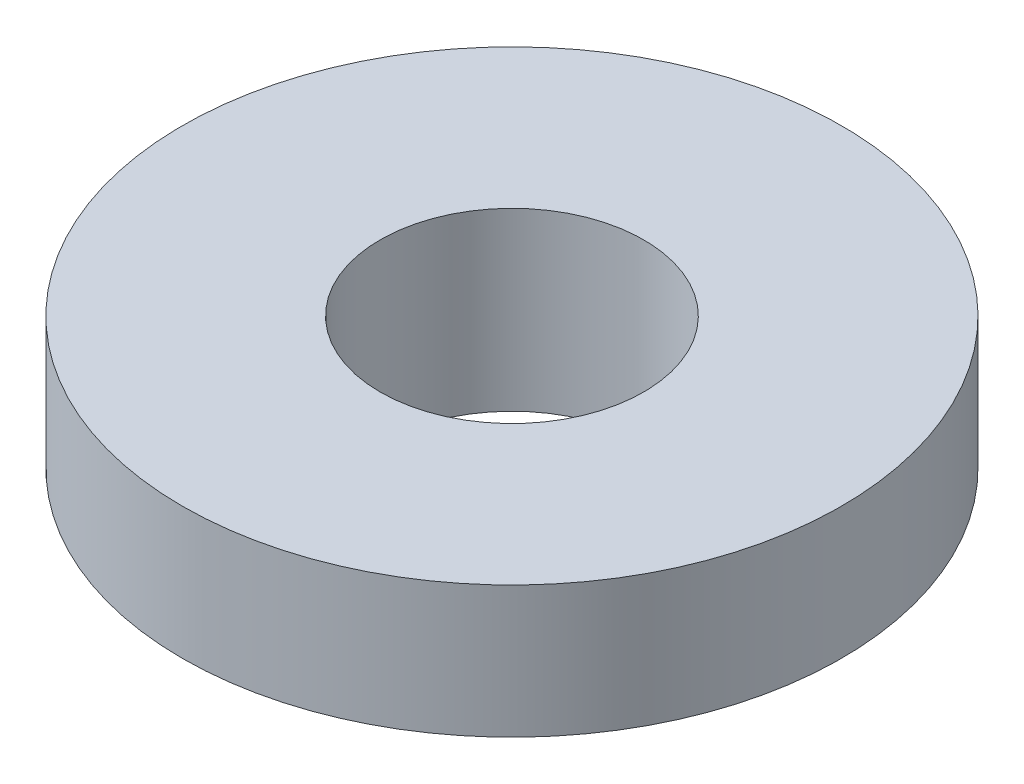
from build123d import *

# Parameters (mm, degrees)
ESQUISSE1_R        = 3.75
ESQUISSE1_R_2      = 2.5
ESQUISSE1_R_3      = 1.5
BOSS_EXTRU_1_DEPTH = 1.5
BOSS_EXTRU_2_START = -0.5
ESQUISSE1_3_R      = 2.5
ESQUISSE1_3_R_2    = 1.5
BOSS_EXTRU_2_DEPTH = 0.5


with BuildPart() as part:
    # Esquisse1 → Boss.-Extru.1 (new body)
    # profile 1 of 2: a face of its own
    with BuildSketch(Plane(origin=(0, 0, 0), x_dir=(1, 0, 0), z_dir=(0, 1, 0))):
        with Locations(Location((0, 0, 0), (0, 0, 270))):
            Circle(ESQUISSE1_R)
        Circle(ESQUISSE1_R_2, mode=Mode.SUBTRACT)
    # profile 2 of 2: a face of its own
    with BuildSketch(Plane(origin=(0, 0, 0), x_dir=(1, 0, 0), z_dir=(0, 1, 0))):
        Circle(ESQUISSE1_R_2)
        with Locations(Location((0, 0, 0), (0, 0, 270))):
            Circle(ESQUISSE1_R_3, mode=Mode.SUBTRACT)
    extrude(amount=BOSS_EXTRU_1_DEPTH)

    # Esquisse1<3> → Boss.-Extru.2 (add)
    with BuildSketch(Plane(origin=(0, 0, 0), x_dir=(1, 0, 0), z_dir=(0, 1, 0)).offset(BOSS_EXTRU_2_START)):
        with Locations(Location((0, 0, 0), (0, 0, 270))):
            Circle(ESQUISSE1_3_R)
        with Locations(Location((0, 0, 0), (0, 0, 270))):
            Circle(ESQUISSE1_3_R_2, mode=Mode.SUBTRACT)
    extrude(amount=BOSS_EXTRU_2_DEPTH)


solid = part.part
